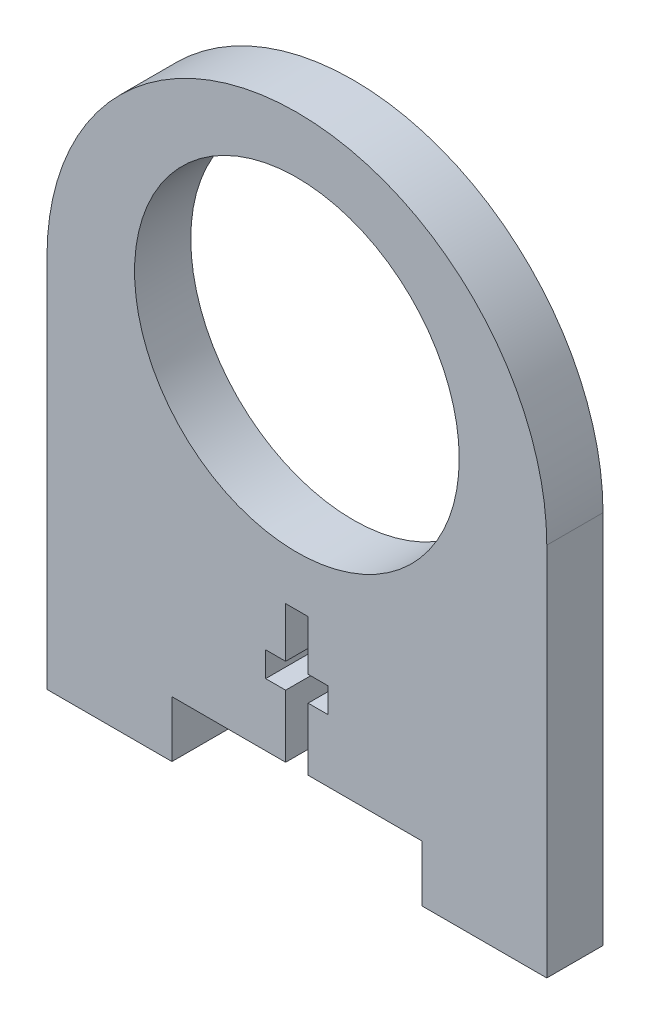
from build123d import *

# Parameters (mm, degrees)
BOSS_EXTRUDE1_DEPTH = 5.715
CUT_EXTRUDE1_REACH  = 53.513
SKETCH2_R           = 16.5
CUT_EXTRUDE2_REACH  = 53.513
SKETCH3_W           = 25.4
SKETCH3_H           = 5.715
CUT_EXTRUDE4_REACH  = 53.513


with BuildPart() as part:
    # Sketch1 → Boss-Extrude1 (new body)
    with BuildSketch(Plane.XY):
        with BuildLine():
            Line((25.4, -19.05), (-25.4, -19.05))
            Line((-25.4, -19.05), (-25.4, 19.05))
            ThreePointArc((-25.4, 19.05), (0, 44.45), (25.4, 19.05))
            Line((25.4, 19.05), (25.4, -19.05))
        make_face()
    extrude(amount=BOSS_EXTRUDE1_DEPTH)

    # Sketch2 → Cut-Extrude1 (cut, up to next)
    with BuildSketch(Plane.XY.offset(5.715), mode=Mode.PRIVATE) as cut_extrude1_sk1:
        with Locations((0, 22.21484)):
            Circle(SKETCH2_R)
    cut_extrude1_tool1 = extrude(cut_extrude1_sk1.sketch, amount=-CUT_EXTRUDE1_REACH, mode=Mode.PRIVATE) & part.part
    add(cut_extrude1_tool1.solids().sort_by_distance((0, 22.21484, 5.715))[0], mode=Mode.SUBTRACT)

    # Sketch3 → Cut-Extrude2 (cut, up to next)
    with BuildSketch(Plane.XY.offset(5.715), mode=Mode.PRIVATE) as cut_extrude2_sk1:
        with Locations((0, -16.1925)):
            Rectangle(SKETCH3_W, SKETCH3_H)
    cut_extrude2_tool1 = extrude(cut_extrude2_sk1.sketch, amount=-CUT_EXTRUDE2_REACH, mode=Mode.PRIVATE) & part.part
    add(cut_extrude2_tool1.solids().sort_by_distance((0, -16.1925, 5.715))[0], mode=Mode.SUBTRACT)

    # Sketch5 → Cut-Extrude4 (cut, up to next)
    with BuildSketch(Plane.XY.offset(5.715), mode=Mode.PRIVATE) as cut_extrude4_sk1:
        Polygon((3.175, -6.985), (1.143, -6.985), (1.143, -13.335), (-1.143, -13.335), (-1.143, -6.985), (-3.175, -6.985), (-3.175, -4.445), (-1.143, -4.445), (-1.143, 0.635), (1.143, 0.635), (1.143, -4.445), (3.175, -4.445), align=None)
    cut_extrude4_tool1 = extrude(cut_extrude4_sk1.sketch, amount=-CUT_EXTRUDE4_REACH, mode=Mode.PRIVATE) & part.part
    add(cut_extrude4_tool1.solids().sort_by_distance((0, -6.194885, 5.715))[0], mode=Mode.SUBTRACT)


solid = part.part
